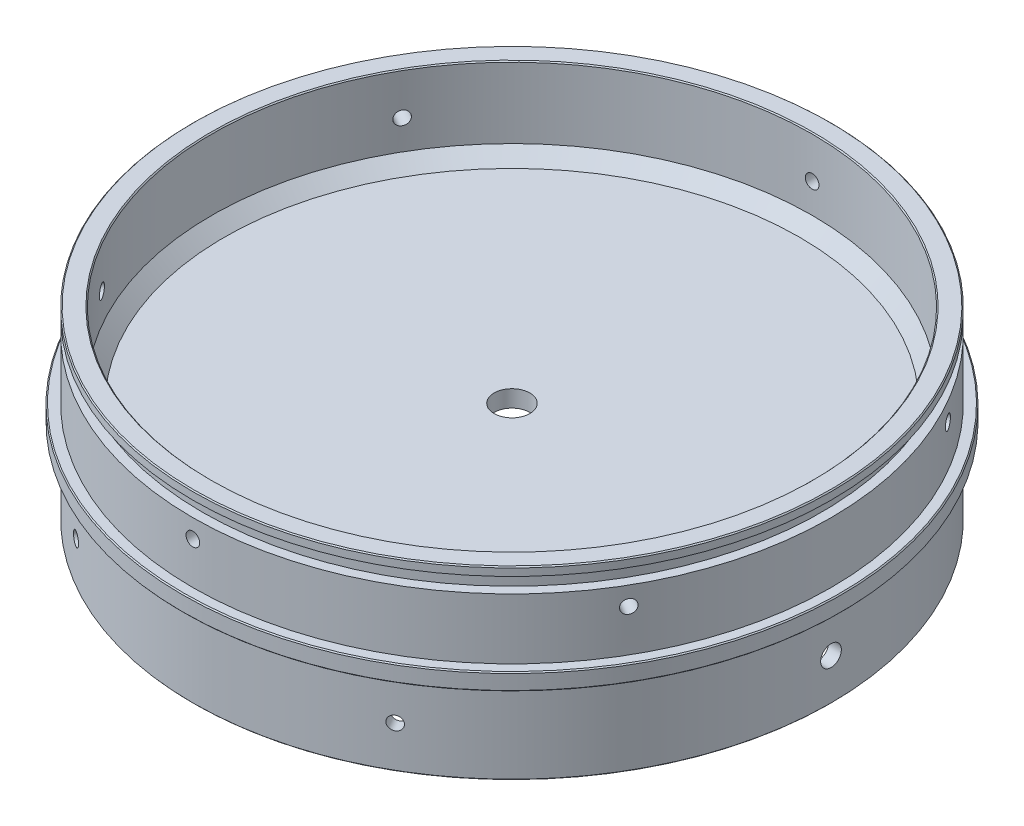
from build123d import *

# Parameters (mm, degrees)
BOSS_EXTRUDE1_START      = 20
SKETCH2_R                = 75.89
BOSS_EXTRUDE1_DEPTH      = 20
M3_CLEARANCE_HOLE1_D     = 3.24
M3_CLEARANCE_HOLE1_DEPTH = 156.298383092
M3_CLEARANCE_HOLE2_D     = 3.24
M3_CLEARANCE_HOLE2_DEPTH = 156.298383092
M3_CLEARANCE_HOLE3_D     = 3.24
M3_CLEARANCE_HOLE3_DEPTH = 156.298383092
HOLE1_REACH              = 178.309
HOLE1_BORE_R             = 2.46
M3_CLEARANCE_HOLE4_D     = 3.24
M3_CLEARANCE_HOLE4_DEPTH = 154.24
M3_CLEARANCE_HOLE5_D     = 3.24
M3_CLEARANCE_HOLE5_DEPTH = 154.798004693
M3_CLEARANCE_HOLE6_D     = 3.24
M3_CLEARANCE_HOLE6_DEPTH = 154.798004693
CHAMFER1_SIZE            = 0.25
CHAMFER2_SIZE            = 3


with BuildPart() as part:
    # Sketch1 → Revolve1 (revolve)
    with BuildSketch(Plane(origin=(0, 0, 0), x_dir=(-1, 0, 0), z_dir=(0, 0, -1)), mode=Mode.PRIVATE) as revolve1_sk:
        Polygon((-78.35, 0), (0, 0), (0, 24), (-75.89, 24), (-75.89, 22), (-73.64, 22), (-73.64, 18.4), (-75.89, 18.4), (-75.89, 4), (-78.35, 4), align=None)
    revolve(revolve1_sk.sketch.rotate(Axis((0, 0, 0), (0, 1, 0)), 270), axis=Axis((0, 0, 0), (0, 1, 0)))

    # Sketch2 → Boss-Extrude1 (add)
    with BuildSketch(Plane.XZ.offset(BOSS_EXTRUDE1_START)):
        with Locations(Location((0, 0, 0), (0, 0, 90))):
            Circle(SKETCH2_R)
    extrude(amount=-BOSS_EXTRUDE1_DEPTH)

    # Sketch3 → Cut-Revolve1 (revolve, cut)
    with BuildSketch(Plane.XY, mode=Mode.PRIVATE) as cut_revolve1_sk:
        Polygon((71.39, 24), (0, 24), (0, -20), (72.89, -20), (72.89, 0), (4.25, 0), (4.25, 4), (71.39, 4), align=None)
    revolve(cut_revolve1_sk.sketch.rotate(Axis((0, 24, 0), (0, -1, 0)), 270), axis=Axis((0, 24, 0), (0, -1, 0)), mode=Mode.SUBTRACT)

    # M3 Clearance Hole1
    with Locations(Plane(origin=(65.722667893, 14, -37.945), x_dir=(0.5, 0, 0.866025403784), z_dir=(0.866025403784, 0, -0.5))):
        with Locations((0, 0)):
            Hole(M3_CLEARANCE_HOLE1_D / 2, depth=M3_CLEARANCE_HOLE1_DEPTH)

    # M3 Clearance Hole2
    with Locations(Plane(origin=(65.722667893, 14, 37.945), x_dir=(-0.5, 0, 0.866025403784), z_dir=(0.866025403784, 0, 0.5))):
        with Locations((0, 0)):
            Hole(M3_CLEARANCE_HOLE2_D / 2, depth=M3_CLEARANCE_HOLE2_DEPTH)

    # M3 Clearance Hole3
    with Locations(Plane(origin=(0, 14, 75.89), x_dir=(1, 0, 0), z_dir=(0, 0, 1))):
        with Locations((0, 0)):
            Hole(M3_CLEARANCE_HOLE3_D / 2, depth=M3_CLEARANCE_HOLE3_DEPTH)

    # Hole1 bore (on position points) → Hole1 (cut, up to next)
    with BuildSketch(Plane(origin=(75.89, -10, 0), x_dir=(0, 0, 1), z_dir=(1, 0, 0)), mode=Mode.PRIVATE) as hole1_sk1:
        Circle(HOLE1_BORE_R)
    hole1_tool1 = extrude(hole1_sk1.sketch, amount=-HOLE1_REACH, mode=Mode.PRIVATE) & part.part
    add(hole1_tool1.solids().sort_by_distance((75.89, -10, 0))[0], mode=Mode.SUBTRACT)

    # M3 Clearance Hole4
    with Locations(Plane(origin=(-75.89, -10, 0), x_dir=(0, 0, -1), z_dir=(-1, 0, 0))):
        with Locations((0, 0)):
            Hole(M3_CLEARANCE_HOLE4_D / 2, depth=M3_CLEARANCE_HOLE4_DEPTH)

    # M3 Clearance Hole5
    with Locations(Plane(origin=(37.945, -10, -65.722667893), x_dir=(-0.866025403784, 0, -0.5), z_dir=(0.5, 0, -0.866025403784))):
        with Locations((0, 0)):
            Hole(M3_CLEARANCE_HOLE5_D / 2, depth=M3_CLEARANCE_HOLE5_DEPTH)

    # M3 Clearance Hole6
    with Locations(Plane(origin=(37.945, -10, 65.722667893), x_dir=(0.866025403784, 0, -0.5), z_dir=(0.5, 0, 0.866025403784))):
        with Locations((0, 0)):
            Hole(M3_CLEARANCE_HOLE6_D / 2, depth=M3_CLEARANCE_HOLE6_DEPTH)

    # Chamfer1
    chamfer1_edges = [part.edges().sort_by_distance(p)[0] for p in [
        (0, 24, -75.89),
        (0, 0, -78.35),
        (0, -20, -75.89),
        (0, 24, 71.39),
        (0, -20, 72.89),
        (0, 4, -78.35),
    ]]
    chamfer(chamfer1_edges, length=CHAMFER1_SIZE)

    # Chamfer2
    chamfer2_edges = [part.edges().sort_by_distance(p)[0] for p in [
        (0, 0, 72.89),
        (0, 4, 71.39),
    ]]
    chamfer(chamfer2_edges, length=CHAMFER2_SIZE)


solid = part.part
